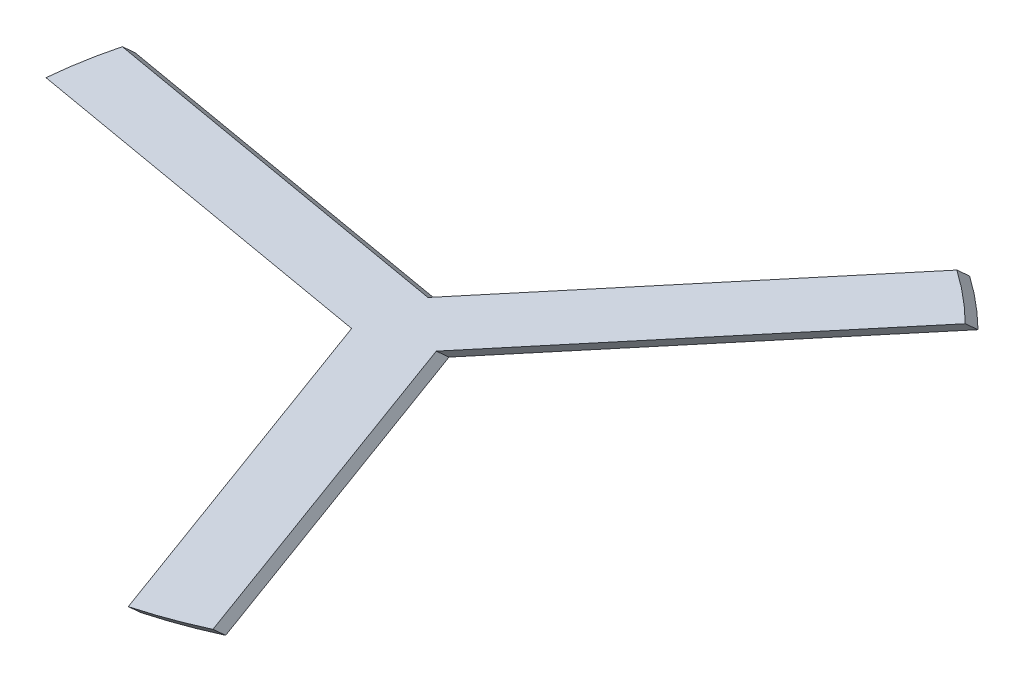
from build123d import *


with BuildPart() as part:
    # Sweep8: sweep along a curve in space
    with BuildLine() as sweep8_path:
        Line((-4391.560400513, 0, -1271.763047368), (-4423.346397996, 101.6, -1156.369596338))
    # Sketch3 → Sweep8 (sweep)
    with BuildSketch(Plane(origin=(0, 101.6, 0), x_dir=(1, 0, 0), z_dir=(0, 1, 0))):
        with BuildLine():
            Line((-151.40316522, 413.067889773), (-4423.346397996, 1156.369596338))
            ThreePointArc((-4423.346397996, 1156.369596338), (-4504.324931719, 783.735229201), (-4553.968936196, 405.648774386))
            Line((-4553.968936196, 405.648774386), (-282.025703421, -337.652932181))
            Line((-282.025703421, -337.652932181), (1210.227752405, -4408.915148572))
            ThreePointArc((1210.227752405, -4408.915148572), (1573.427847531, -4292.72743237), (1925.682324466, -4146.677173984))
            Line((1925.682324466, -4146.677173984), (433.428868641, -75.414957593))
            Line((433.428868641, -75.414957593), (3213.118645591, 3252.545552233))
            ThreePointArc((3213.118645591, 3252.545552233), (2930.897084189, 3508.992203168), (2628.28661173, 3741.028399598))
            Line((2628.28661173, 3741.028399598), (-151.40316522, 413.067889773))
        make_face()
    sweep(path=sweep8_path.line)


solid = part.part
